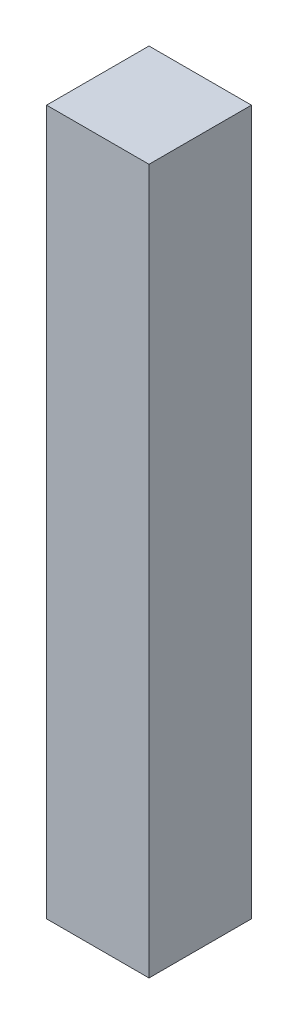
from build123d import *

# Parameters (mm, degrees)
SKETCH1_W           = 14.986
SKETCH1_H           = 14.986
BOSS_EXTRUDE1_DEPTH = 103.1113


with BuildPart() as part:
    # Sketch1 → Boss-Extrude1 (new body)
    with BuildSketch(Plane(origin=(0, 0, 0), x_dir=(1, 0, 0), z_dir=(0, 1, 0))):
        Rectangle(SKETCH1_W, SKETCH1_H)
    extrude(amount=BOSS_EXTRUDE1_DEPTH)


solid = part.part
